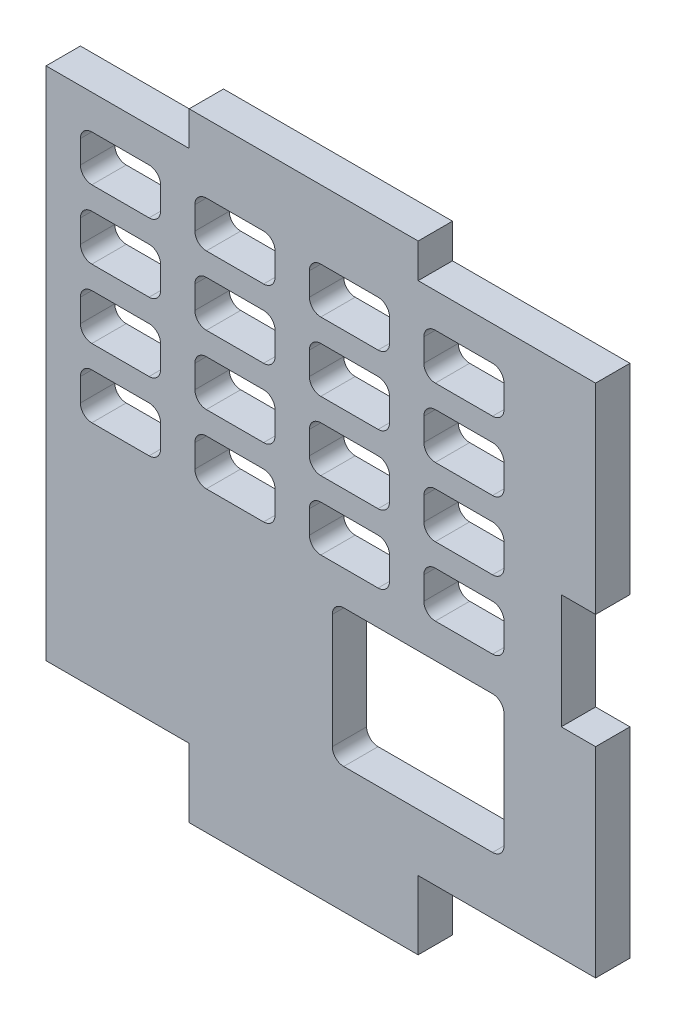
from build123d import *

# Parameters (mm, degrees)
BOSS_EXTRUDE1_DEPTH  = 3
SKETCH2_W            = 15
SKETCH2_H            = 12
CUT_EXTRUDE1_DEPTH   = 68.948509917
FILLET1_R            = 1
CUT_EXTRUDE2_DEPTH   = 68.948509917
LPATTERN1_COUNT      = 4
LPATTERN1_PITCH      = 10
LPATTERN1_COUNT_DIR2 = 4
LPATTERN1_PITCH_DIR2 = 6


with BuildPart() as part:
    # Sketch1 → Boss-Extrude1 (new body)
    with BuildSketch(Plane.XY):
        Polygon((0, 0), (0, 45), (12.5, 45), (12.5, 48), (32.5, 48), (32.5, 45), (48, 45), (48, 27.5), (45, 27.5), (45, 17.5), (48, 17.5), (48, 0), (32.5, 0), (32.5, -6), (12.5, -6), (12.5, 0), align=None)
    extrude(amount=BOSS_EXTRUDE1_DEPTH)

    # Sketch2 → Cut-Extrude1 (cut, through all)
    with BuildSketch(Plane.XY.offset(3)):
        with Locations((32.5, 11)):
            Rectangle(SKETCH2_W, SKETCH2_H)
    extrude(amount=-CUT_EXTRUDE1_DEPTH, mode=Mode.SUBTRACT)

    # Fillet1
    fillet1_edges = [part.edges().sort_by_distance(p)[0] for p in [
        (25, 5, 1.5),
        (25, 17, 1.5),
        (40, 17, 1.5),
        (40, 5, 1.5),
    ]]
    fillet(fillet1_edges, radius=FILLET1_R)

    # Sketch3 → Cut-Extrude2 (cut, through all)
    with BuildSketch(Plane.XY.offset(3)):
        with BuildLine():
            Line((4, 42), (9, 42))
            ThreePointArc((9, 42), (9.707106781, 41.707106781), (10, 41))
            Line((10, 41), (10, 39))
            ThreePointArc((10, 39), (9.707106781, 38.292893219), (9, 38))
            Line((9, 38), (4, 38))
            ThreePointArc((4, 38), (3.292893219, 38.292893219), (3, 39))
            Line((3, 39), (3, 41))
            ThreePointArc((3, 41), (3.292893219, 41.707106781), (4, 42))
        make_face()
    cut_extrude2 = extrude(amount=-CUT_EXTRUDE2_DEPTH, mode=Mode.SUBTRACT)

    # LPattern1: Cut-Extrude2 4 × 4
    with Locations(*[(i * LPATTERN1_PITCH, -j * LPATTERN1_PITCH_DIR2, 0) for i in range(LPATTERN1_COUNT) for j in range(LPATTERN1_COUNT_DIR2) if (i, j) != (0, 0)]):
        add(cut_extrude2, mode=Mode.SUBTRACT)


solid = part.part
